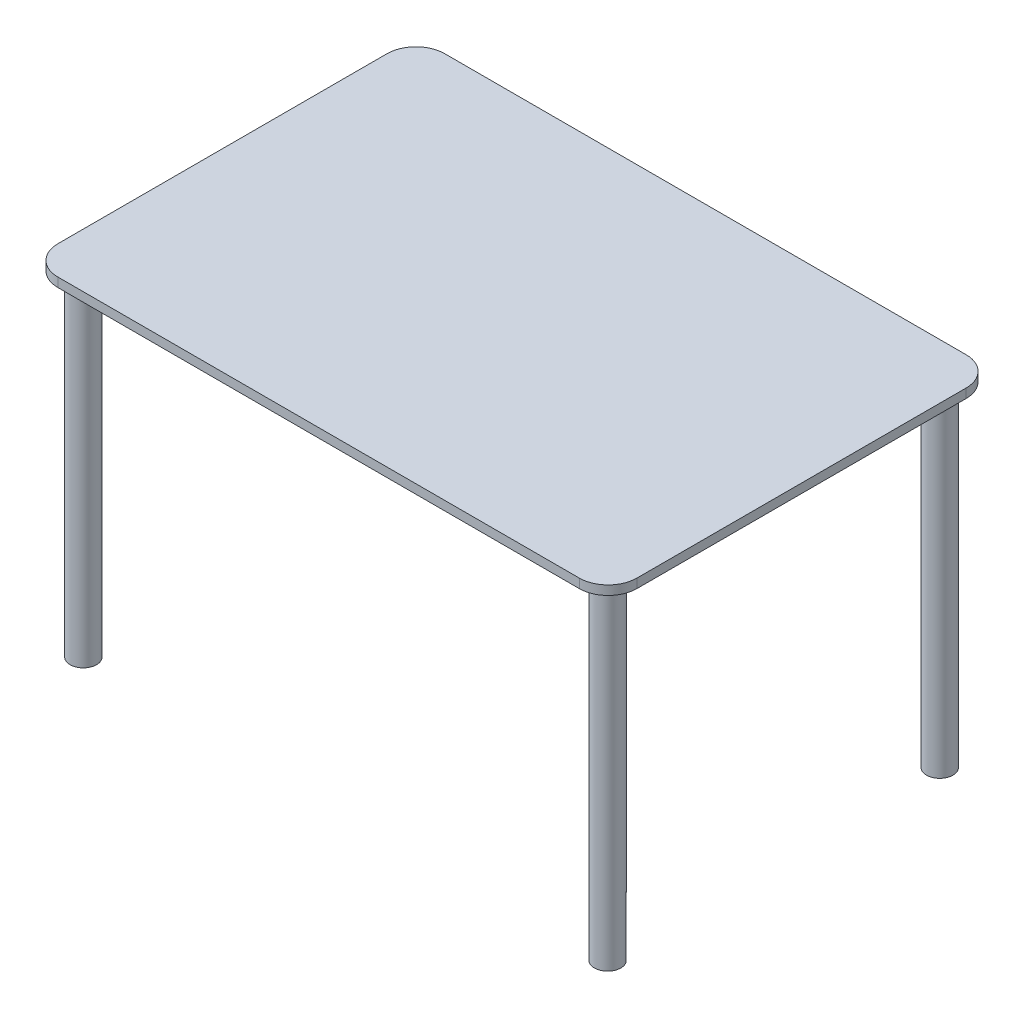
from build123d import *

# Parameters (mm, degrees)
SKETCH1_W           = 1205
SKETCH1_H           = 805
BOSS_EXTRUDE1_DEPTH = 19
SKETCH2_R           = 27.5
BOSS_EXTRUDE2_DEPTH = 696
FILLET1_R           = 60


with BuildPart() as part:
    # Sketch1 → Boss-Extrude1 (new body)
    with BuildSketch(Plane(origin=(0, 0, 0), x_dir=(1, 0, 0), z_dir=(0, 1, 0))):
        Rectangle(SKETCH1_W, SKETCH1_H)
    extrude(amount=BOSS_EXTRUDE1_DEPTH)

    # Sketch2 → Boss-Extrude2 (add)
    with BuildSketch(Plane(origin=(0, 0, 0), x_dir=(-1, 0, 0), z_dir=(0, -1, 0))):
        with Locations(Location((546, 346, 0), (0, 0, 270))):
            Circle(SKETCH2_R)
        with Locations(Location((-544.120521212, 346, 0), (0, 0, 270))):
            Circle(SKETCH2_R)
        with Locations(Location((-546, -347.089225584, 0), (0, 0, 270))):
            Circle(SKETCH2_R)
        with Locations(Location((546, -346, 0), (0, 0, 270))):
            Circle(SKETCH2_R)
    extrude(amount=BOSS_EXTRUDE2_DEPTH)

    # Fillet1
    fillet1_edges = [part.edges().sort_by_distance(p)[0] for p in [
        (-602.5, 9.5, -402.5),
        (-602.5, 9.5, 402.5),
        (602.5, 9.5, 402.5),
        (602.5, 9.5, -402.5),
    ]]
    fillet(fillet1_edges, radius=FILLET1_R)


solid = part.part
